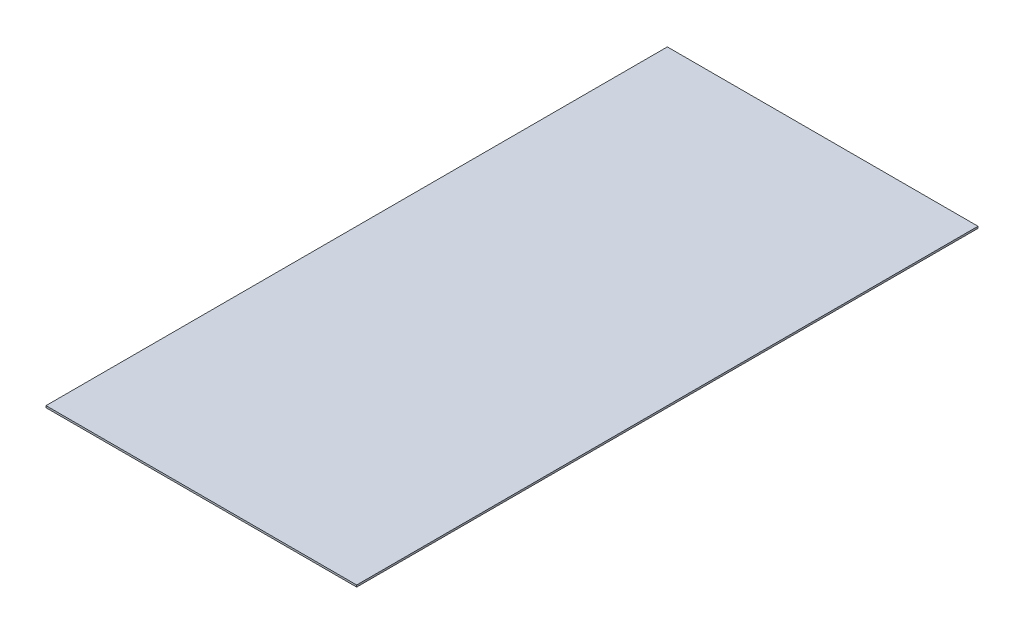
from build123d import *

# Parameters (mm, degrees)
IZIM1_W                     = 500
IZIM1_H                     = 1000
Y_KSEKLIK_EKSTR_ZYON1_DEPTH = 3


with BuildPart() as part:
    # Çizim1 → Yükseklik-Ekstrüzyon1 (new body)
    with BuildSketch(Plane(origin=(0, 0, 0), x_dir=(1, 0, 0), z_dir=(0, 1, 0))):
        with Locations((250, 500)):
            Rectangle(IZIM1_W, IZIM1_H)
    extrude(amount=Y_KSEKLIK_EKSTR_ZYON1_DEPTH)


solid = part.part
